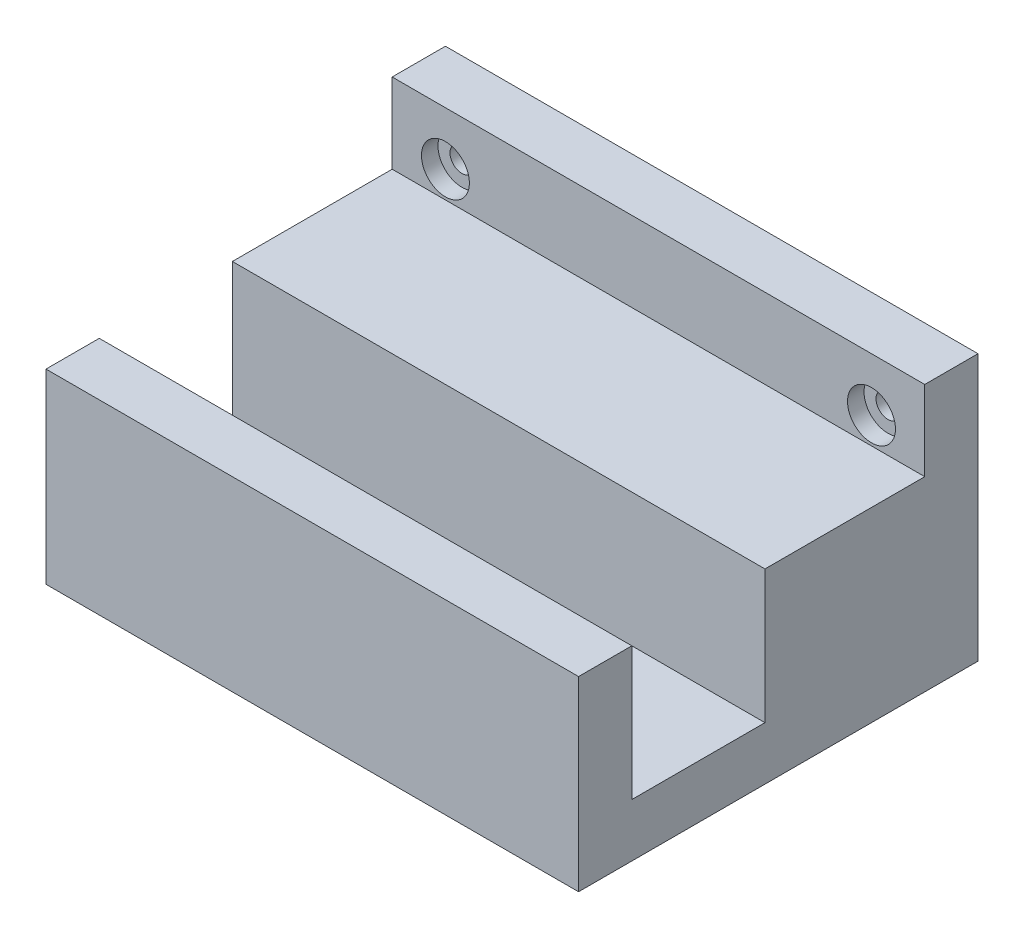
from build123d import *

# Parameters (mm, degrees)
CROQUIS1_W                                           = 100
CROQUIS1_H                                           = 50
SALIENTE_EXTRUIR1_DEPTH                              = 10
CROQUIS2_W                                           = 100
CROQUIS2_H                                           = 10
SALIENTE_EXTRUIR2_DEPTH                              = 75
CROQUIS3_W                                           = 100
CROQUIS3_H                                           = 35
SALIENTE_EXTRUIR3_DEPTH                              = 10
REFRENTADO_PARA_TORNILLO_CON_CABEZA_TRON_D           = 4.5
REFRENTADO_PARA_TORNILLO_CON_CABEZA_TRON_CBORE_D     = 9
REFRENTADO_PARA_TORNILLO_CON_CABEZA_TRON_CBORE_DEPTH = 3.1
CROQUIS11_W                                          = 100
CROQUIS11_H                                          = 35
SALIENTE_EXTRUIR4_DEPTH                              = 30


with BuildPart() as part:
    # Croquis1 → Saliente-Extruir1 (new body)
    with BuildSketch(Plane.XY):
        Rectangle(CROQUIS1_W, CROQUIS1_H)
    extrude(amount=SALIENTE_EXTRUIR1_DEPTH)

    # Croquis2 → Saliente-Extruir2 (add)
    with BuildSketch(Plane.XY):
        with Locations((0, -20)):
            Rectangle(CROQUIS2_W, CROQUIS2_H)
    extrude(amount=SALIENTE_EXTRUIR2_DEPTH)

    # Croquis3 → Saliente-Extruir3 (add)
    with BuildSketch(Plane.XY.offset(75)):
        with Locations((0, -7.5)):
            Rectangle(CROQUIS3_W, CROQUIS3_H)
    extrude(amount=-SALIENTE_EXTRUIR3_DEPTH)

    # Refrentado para tornillo con cabeza troncocónica de M43 (through all)
    with Locations(Plane(origin=(-40, 15, 10), x_dir=(1, 0, 0), z_dir=(0, 0, 1))):
        with Locations((0, 0), (80, 0)):
            CounterBoreHole(REFRENTADO_PARA_TORNILLO_CON_CABEZA_TRON_D / 2, REFRENTADO_PARA_TORNILLO_CON_CABEZA_TRON_CBORE_D / 2, REFRENTADO_PARA_TORNILLO_CON_CABEZA_TRON_CBORE_DEPTH)

    # Croquis11 → Saliente-Extruir4 (add)
    with BuildSketch(Plane.XY.offset(10)):
        with Locations((0, -7.5)):
            Rectangle(CROQUIS11_W, CROQUIS11_H)
    extrude(amount=SALIENTE_EXTRUIR4_DEPTH)


solid = part.part
